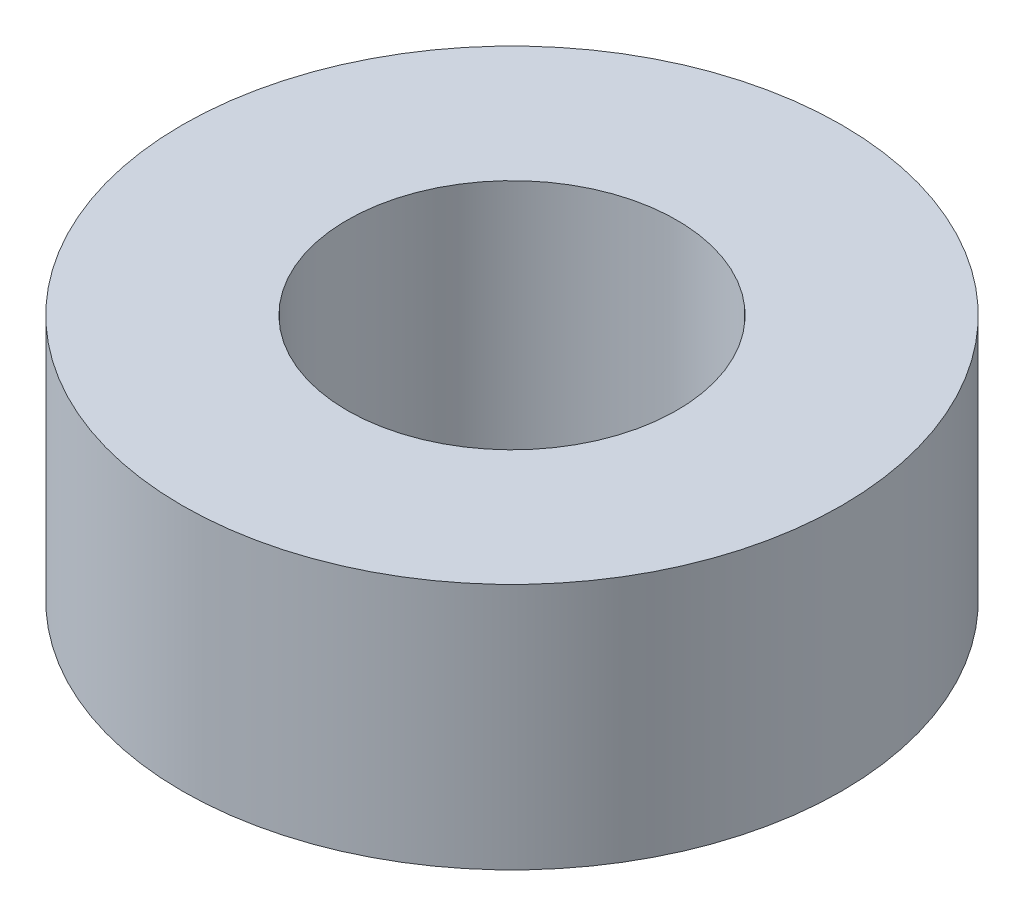
from build123d import *

# Parameters (mm, degrees)
SKETCH2_R           = 4
SKETCH2_R_2         = 2
BOSS_EXTRUDE1_DEPTH = 3


with BuildPart() as part:
    # Sketch2 → Boss-Extrude1 (new body)
    with BuildSketch(Plane(origin=(0, 0, 0), x_dir=(1, 0, 0), z_dir=(0, 1, 0))):
        with Locations(Location((0, 0, 0), (0, 0, 270))):
            Circle(SKETCH2_R)
        with Locations(Location((0, 0, 0), (0, 0, 270))):
            Circle(SKETCH2_R_2, mode=Mode.SUBTRACT)
    extrude(amount=BOSS_EXTRUDE1_DEPTH)


solid = part.part
